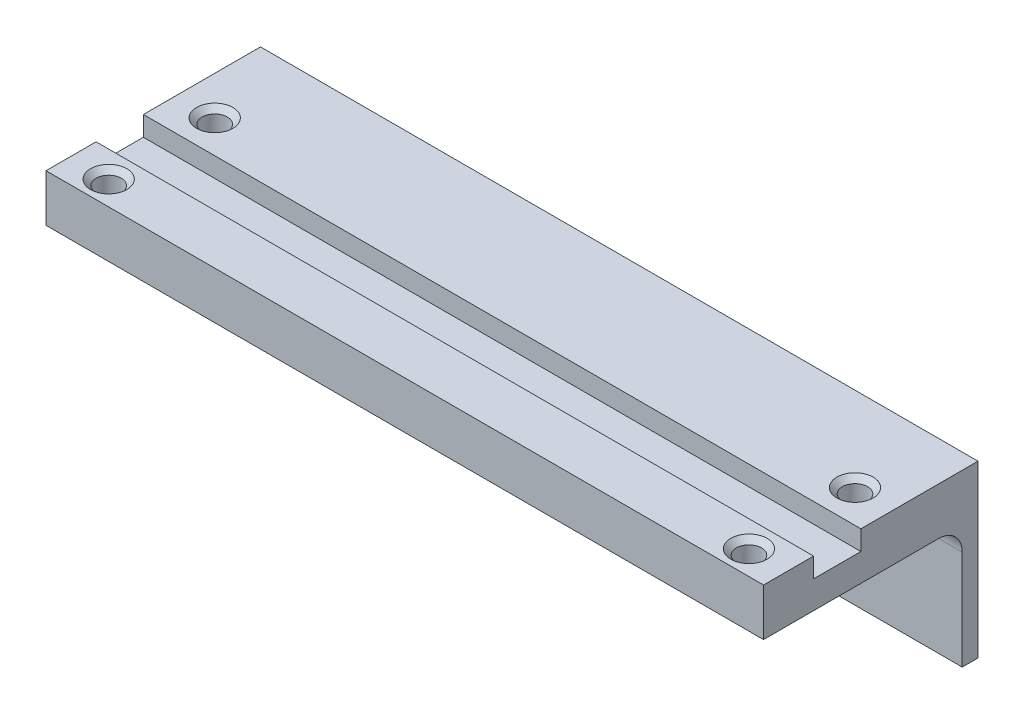
from build123d import *

# Parameters (mm, degrees)
SKETCH1_W           = 91
SKETCH1_H           = 24
BOSS_EXTRUDE1_DEPTH = 4
SKETCH2_R           = 1.6
CUT_EXTRUDE1_DEPTH  = 48.22552276
SKETCH3_W           = 91
SKETCH3_H           = 6
CUT_EXTRUDE2_DEPTH  = 2.5
SKETCH4_W           = 91
SKETCH4_H           = 4
BOSS_EXTRUDE2_DEPTH = 2.2
SKETCH5_W           = 91
SKETCH5_H           = 2
BOSS_EXTRUDE3_DEPTH = 17.62
SKETCH6_R           = 1.75
CUT_EXTRUDE3_DEPTH  = 55.464248824
SKETCH7_W           = 91
SKETCH7_H           = 24.2
SKETCH7_R           = 1.6
BOSS_EXTRUDE5_DEPTH = 2
SKETCH8_W           = 91
SKETCH8_H           = 6
BOSS_EXTRUDE6_DEPTH = 1
CHAMFER1_SIZE       = 0.7
FILLET1_R           = 3


with BuildPart() as part:
    # Sketch1 → Boss-Extrude1 (new body)
    with BuildSketch(Plane(origin=(0, 0, 0), x_dir=(1, 0, 0), z_dir=(0, 1, 0))):
        Rectangle(SKETCH1_W, SKETCH1_H)
    extrude(amount=BOSS_EXTRUDE1_DEPTH)

    # Sketch2 → Cut-Extrude1 (cut, through all)
    with BuildSketch(Plane(origin=(0, 4, 0), x_dir=(1, 0, 0), z_dir=(0, 1, 0))):
        with Locations(Location((-40.6, 3.5, 0), (0, 0, 270))):
            Circle(SKETCH2_R)
        with Locations(Location((-40.6, -9.95, 0), (0, 0, 270))):
            Circle(SKETCH2_R)
        with Locations(Location((40.6, 3.5, 0), (0, 0, 270))):
            Circle(SKETCH2_R)
        with Locations(Location((40.6, -9.95, 0), (0, 0, 270))):
            Circle(SKETCH2_R)
    extrude(amount=-CUT_EXTRUDE1_DEPTH, mode=Mode.SUBTRACT)

    # Sketch3 → Cut-Extrude2 (cut)
    with BuildSketch(Plane(origin=(0, 4, 0), x_dir=(1, 0, 0), z_dir=(0, 1, 0))):
        with Locations((0, -3.65)):
            Rectangle(SKETCH3_W, SKETCH3_H)
    extrude(amount=-CUT_EXTRUDE2_DEPTH, mode=Mode.SUBTRACT)

    # Sketch4 → Boss-Extrude2 (add)
    with BuildSketch(Plane(origin=(0, 0, -12), x_dir=(-1, 0, 0), z_dir=(0, 0, -1))):
        with Locations((0, 2)):
            Rectangle(SKETCH4_W, SKETCH4_H)
    extrude(amount=BOSS_EXTRUDE2_DEPTH)

    # Sketch5 → Boss-Extrude3 (add)
    with BuildSketch(Plane.XZ):
        with Locations((0, -13.2)):
            Rectangle(SKETCH5_W, SKETCH5_H)
    extrude(amount=BOSS_EXTRUDE3_DEPTH)

    # Sketch6 → Cut-Extrude3 (cut, through all)
    with BuildSketch(Plane.XY.offset(-12.2)):
        with Locations((-21.25, -10.12)):
            Circle(SKETCH6_R)
        with Locations((0, -10.12)):
            Circle(SKETCH6_R)
        with Locations((21.25, -10.12)):
            Circle(SKETCH6_R)
    extrude(amount=-CUT_EXTRUDE3_DEPTH, mode=Mode.SUBTRACT)

    # Sketch7 → Boss-Extrude5 (add)
    with BuildSketch(Plane.XZ):
        with Locations((0, -0.1)):
            Rectangle(SKETCH7_W, SKETCH7_H)
        with Locations(Location((40.6, 9.95, 0), (0, 0, 90))):
            Circle(SKETCH7_R, mode=Mode.SUBTRACT)
        with Locations(Location((40.6, -3.5, 0), (0, 0, 90))):
            Circle(SKETCH7_R, mode=Mode.SUBTRACT)
        with Locations(Location((-40.6, -3.5, 0), (0, 0, 90))):
            Circle(SKETCH7_R, mode=Mode.SUBTRACT)
        with Locations(Location((-40.6, 9.95, 0), (0, 0, 90))):
            Circle(SKETCH7_R, mode=Mode.SUBTRACT)
    extrude(amount=BOSS_EXTRUDE5_DEPTH)

    # Sketch8 → Boss-Extrude6 (add)
    with BuildSketch(Plane.XY.offset(12)):
        with Locations((0, 1)):
            Rectangle(SKETCH8_W, SKETCH8_H)
    extrude(amount=BOSS_EXTRUDE6_DEPTH)

    # Chamfer1
    chamfer1_edges = [part.edges().sort_by_distance(p)[0] for p in [
        (40.6, 4, 8.35),
        (-40.6, 4, -5.1),
        (40.6, 4, -5.1),
        (-40.6, 4, 8.35),
    ]]
    chamfer(chamfer1_edges, length=CHAMFER1_SIZE)

    # Fillet1
    fillet1_edges = [part.edges().sort_by_distance(p)[0] for p in [
        (0, -2, -12.2),
    ]]
    fillet(fillet1_edges, radius=FILLET1_R)


solid = part.part
